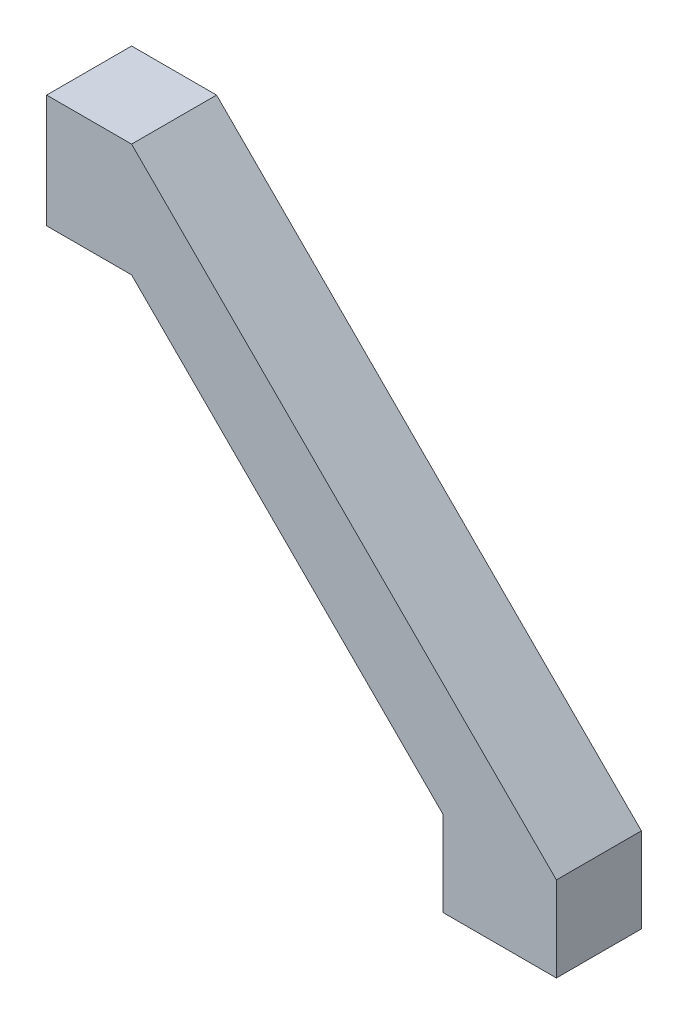
from build123d import *

# Parameters (mm, degrees)
BOSS_EXTRU_1_DEPTH = 6


with BuildPart() as part:
    # Esquisse2 → Boss.-Extru.1 (new body)
    with BuildSketch(Plane.XY):
        Polygon((0, 0), (0, 6), (-30, 36), (-36, 36), (-36, 28), (-30, 28), (-8, 6), (-8, 0), align=None)
    extrude(amount=BOSS_EXTRU_1_DEPTH)


solid = part.part
